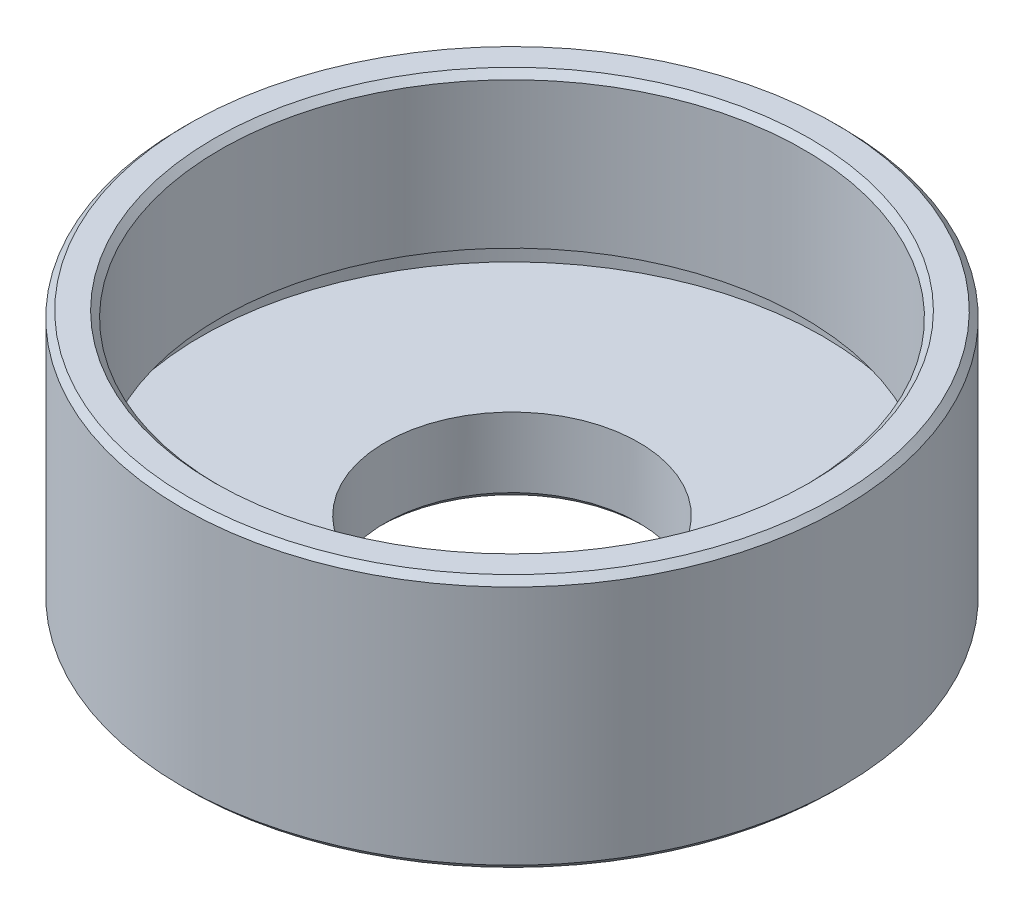
from build123d import *

# Parameters (mm, degrees)
CHAMFER_1_SIZE = 0.5


with BuildPart() as part:
    # Эскиз1 → Повернуть1 (revolve)
    with BuildSketch(Plane.XY):
        Polygon((-26, 20), (-26, 0), (-10, 0), (-10, 6), (-24.5, 6), (-24.5, 8), (-23, 8), (-23, 20), align=None)
    revolve(axis=Axis((0, 26.168985987, 0), (0, -1, 0)))

    # Фаска1
    chamfer_1_edges = [part.edges().sort_by_distance(p)[0] for p in [
        (10, 0, 0),
        (26, 0, 0),
        (26, 20, 0),
        (23, 20, 0),
    ]]
    chamfer(chamfer_1_edges, length=CHAMFER_1_SIZE)


solid = part.part
